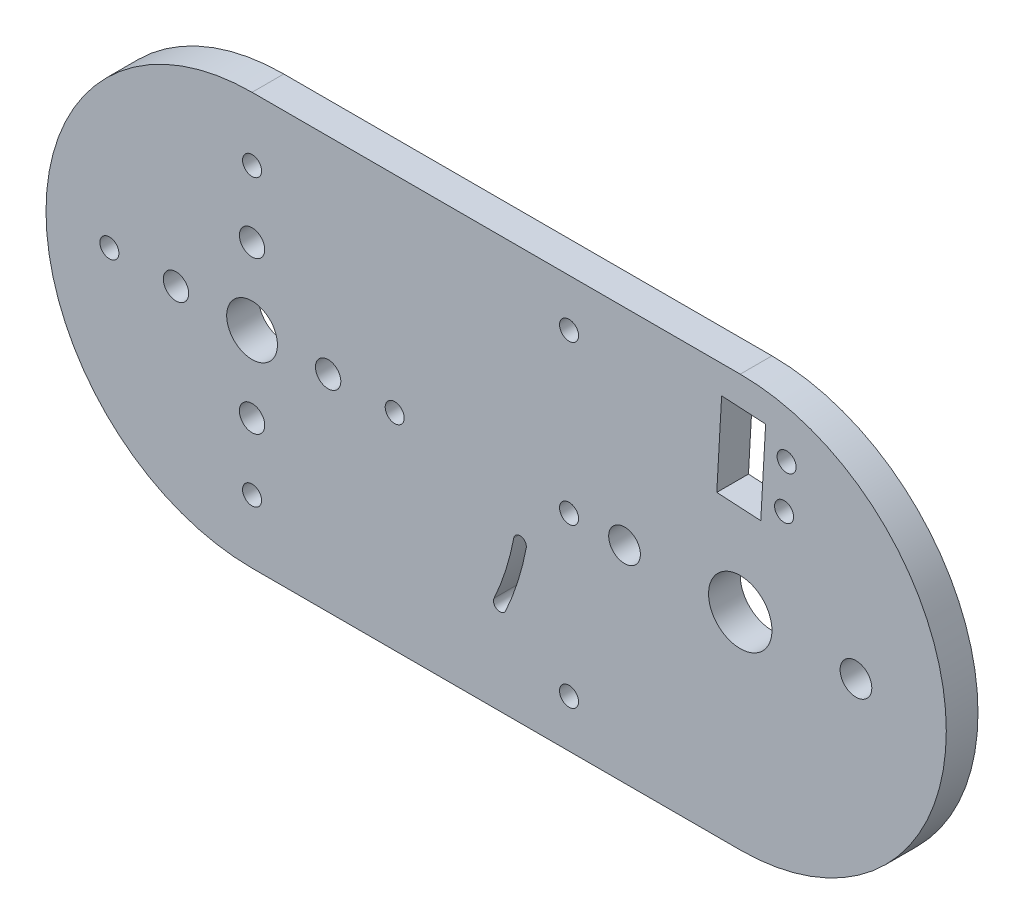
from build123d import *

# Parameters (mm, degrees)
SKETCH1_R           = 4
SKETCH1_R_2         = 5
SKETCH1_R_3         = 2.5
SKETCH1_R_4         = 2
SKETCH1_R_5         = 1.5
BOSS_EXTRUDE1_DEPTH = 5


with BuildPart() as part:
    # Sketch1 → Boss-Extrude1 (new body)
    with BuildSketch(Plane.XY):
        with BuildLine():
            Line((-38.5, 32.5), (38.5, 32.5))
            ThreePointArc((38.5, 32.5), (71, 0), (38.5, -32.5))
            Line((38.5, -32.5), (-38.5, -32.5))
            ThreePointArc((-38.5, -32.5), (-71, 0), (-38.5, 32.5))
        make_face()
        with Locations((-38.5, 0)):
            Circle(SKETCH1_R, mode=Mode.SUBTRACT)
        with Locations((38.5, 0)):
            Circle(SKETCH1_R_2, mode=Mode.SUBTRACT)
        with Locations((20.25, 0)):
            Circle(SKETCH1_R_3, mode=Mode.SUBTRACT)
        with Locations((56.75, 0)):
            Circle(SKETCH1_R_3, mode=Mode.SUBTRACT)
        with Locations((-38.5, -12)):
            Circle(SKETCH1_R_4, mode=Mode.SUBTRACT)
        with Locations((-26.5, 0)):
            Circle(SKETCH1_R_4, mode=Mode.SUBTRACT)
        with Locations((-38.5, 12)):
            Circle(SKETCH1_R_4, mode=Mode.SUBTRACT)
        with Locations((-50.5, 0)):
            Circle(SKETCH1_R_4, mode=Mode.SUBTRACT)
        with Locations((-38.5, 22.5)):
            Circle(SKETCH1_R_5, mode=Mode.SUBTRACT)
        with Locations((-16, 0)):
            Circle(SKETCH1_R_5, mode=Mode.SUBTRACT)
        with Locations((-38.5, -22.5)):
            Circle(SKETCH1_R_5, mode=Mode.SUBTRACT)
        with Locations((-61, 0)):
            Circle(SKETCH1_R_5, mode=Mode.SUBTRACT)
        with Locations((11.5, 0)):
            Circle(SKETCH1_R_5, mode=Mode.SUBTRACT)
        with Locations((11.5, -25)):
            Circle(SKETCH1_R_5, mode=Mode.SUBTRACT)
        with Locations((11.5, 25)):
            Circle(SKETCH1_R_5, mode=Mode.SUBTRACT)
        with Locations((45.81132848, 24.189554469)):
            Circle(SKETCH1_R_5, mode=Mode.SUBTRACT)
        with Locations((45.416389416, 17.200704553)):
            Circle(SKETCH1_R_5, mode=Mode.SUBTRACT)
        Polygon((42.503089082, 27.681767532), (41.735778899, 14.103430555), (34.796849341, 14.495548626), (35.564159523, 28.073885604), align=None, mode=Mode.SUBTRACT)
        with BuildLine():
            ThreePointArc((-0.320277112, -17.501678783), (0.172057271, -18.827426442), (1.49780493, -18.335092058))
            ThreePointArc((1.49780493, -18.335092058), (3.434628419, -13.322422428), (4.745938398, -8.111030272))
            ThreePointArc((4.745938398, -8.111030272), (3.947417759, -6.943826439), (2.780213925, -7.742347078))
            ThreePointArc((2.780213925, -7.742347078), (1.528508946, -12.716857772), (-0.320277112, -17.501678783))
        make_face(mode=Mode.SUBTRACT)
    extrude(amount=BOSS_EXTRUDE1_DEPTH)


solid = part.part
